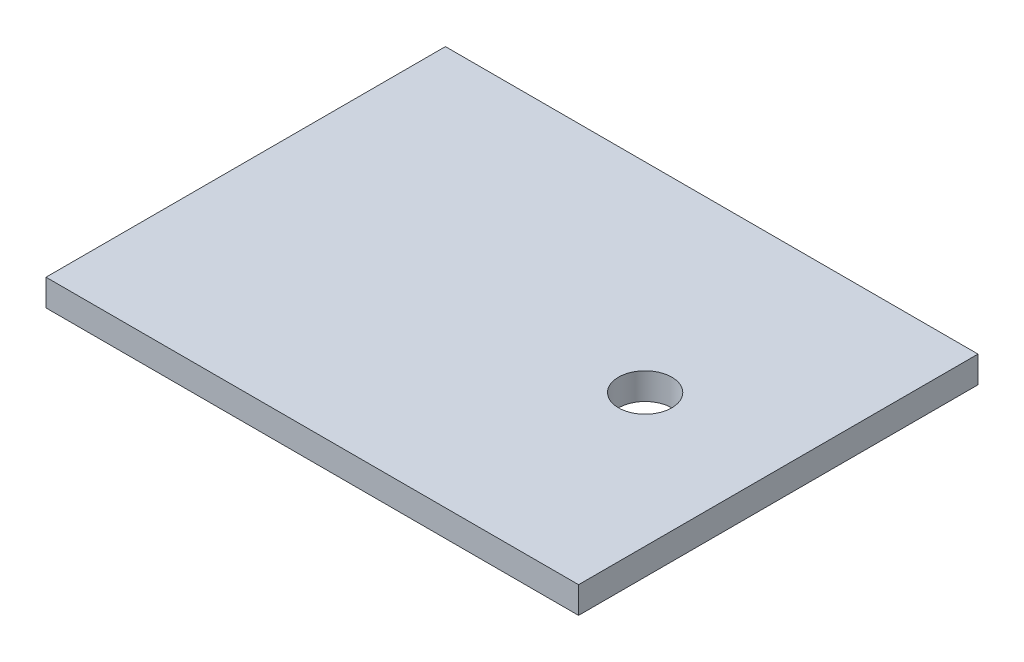
from build123d import *

# Parameters (mm, degrees)
SKETCH1_W           = 200
SKETCH1_H           = 150
BOSS_EXTRUDE1_DEPTH = 10
SKETCH2_R           = 10
CUT_EXTRUDE1_DEPTH  = 20


with BuildPart() as part:
    # Sketch1 → Boss-Extrude1 (new body)
    with BuildSketch(Plane(origin=(0, 0, 0), x_dir=(1, 0, 0), z_dir=(0, 1, 0))):
        Rectangle(SKETCH1_W, SKETCH1_H)
    extrude(amount=BOSS_EXTRUDE1_DEPTH)

    # Sketch2 → Cut-Extrude1 (cut)
    with BuildSketch(Plane(origin=(0, 10, 0), x_dir=(1, 0, 0), z_dir=(0, 1, 0))):
        with Locations(Location((50, 0, 0), (0, 0, 270))):
            Circle(SKETCH2_R)
    extrude(amount=-CUT_EXTRUDE1_DEPTH, mode=Mode.SUBTRACT)


solid = part.part
